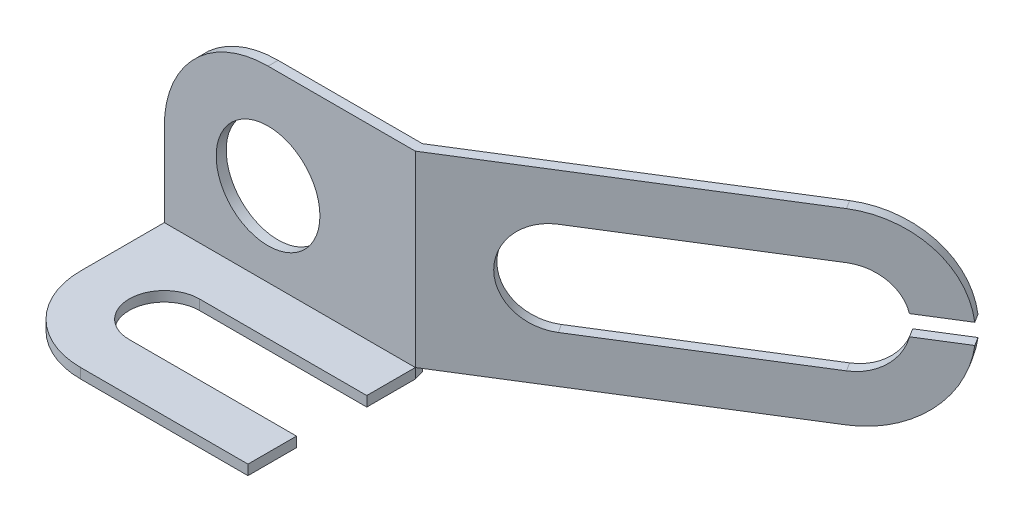
from build123d import *

# Parameters (mm, degrees)
BOSS_EXTRUDE1_DEPTH = 1.524
SKETCH2_R           = 7.874
BOSS_EXTRUDE2_DEPTH = 1.524
BOSS_EXTRUDE3_DEPTH = 1.524
CUT_EXTRUDE1_DEPTH  = 1.524


with BuildPart() as part:
    # Sketch1 → Boss-Extrude1 (new body)
    with BuildSketch(Plane(origin=(0, 0, 0), x_dir=(1, 0, 0), z_dir=(0, 1, 0))):
        with BuildLine():
            Line((0, 0), (-38.1, 0))
            Line((-38.1, 0), (-38.1, -12.7))
            ThreePointArc((-38.1, -12.7), (-34.380256121, -21.680256121), (-25.4, -25.4))
            Line((-25.4, -25.4), (0, -25.4))
            Line((0, -25.4), (0, -18.034))
            Line((0, -18.034), (-25.4, -18.034))
            ThreePointArc((-25.4, -18.034), (-30.734, -12.7), (-25.4, -7.366))
            Line((-25.4, -7.366), (0, -7.366))
            Line((0, -7.366), (0, 0))
        make_face()
    extrude(amount=BOSS_EXTRUDE1_DEPTH)

    # Sketch2 → Boss-Extrude2 (add)
    with BuildSketch(Plane.XY):
        with BuildLine():
            Line((0, 0), (0, 29.972))
            Line((0, 29.972), (-22.352, 29.972))
            ThreePointArc((-22.352, 29.972), (-33.48751759, 25.35951759), (-38.1, 14.224))
            Line((-38.1, 14.224), (-38.1, 0))
            Line((-38.1, 0), (0, 0))
        make_face()
        with Locations((-22.352, 14.224)):
            Circle(SKETCH2_R, mode=Mode.SUBTRACT)
    extrude(amount=-BOSS_EXTRUDE2_DEPTH)

    # Sketch3 → Boss-Extrude3 (add)
    with BuildSketch(Plane(origin=(0, 0, 0), x_dir=(0, 1, 0), z_dir=(0.529919264233206, 0, 0.8480480961564253))):
        with BuildLine():
            Line((29.972, 0), (29.972, -47.498))
            ThreePointArc((29.972, -47.498), (26.330994661, -57.001809762), (17.272, -61.640121482))
            Line((17.272, -61.640121482), (17.272, -54.44479552))
            ThreePointArc((17.272, -54.44479552), (21.289625754, -51.955681909), (22.86, -47.498))
            Line((22.86, -47.498), (22.86, -15.748))
            ThreePointArc((22.86, -15.748), (15.748, -8.636), (8.636, -15.748))
            Line((8.636, -15.748), (8.636, -47.498))
            ThreePointArc((8.636, -47.498), (10.206374246, -51.955681909), (14.224, -54.44479552))
            Line((14.224, -54.44479552), (14.224, -61.640121482))
            ThreePointArc((14.224, -61.640121482), (5.165005339, -57.001809762), (1.524, -47.498))
            Line((1.524, -47.498), (1.524, 0))
            Line((1.524, 0), (29.972, 0))
        make_face()
    extrude(amount=-BOSS_EXTRUDE3_DEPTH)

    # Sketch4 → Cut-Extrude1 (cut)
    with BuildSketch(Plane.XZ):
        Polygon((0, 0), (-0.436999968, -1.524), (0, -1.524), align=None)
    extrude(amount=-CUT_EXTRUDE1_DEPTH, mode=Mode.SUBTRACT)


solid = part.part
